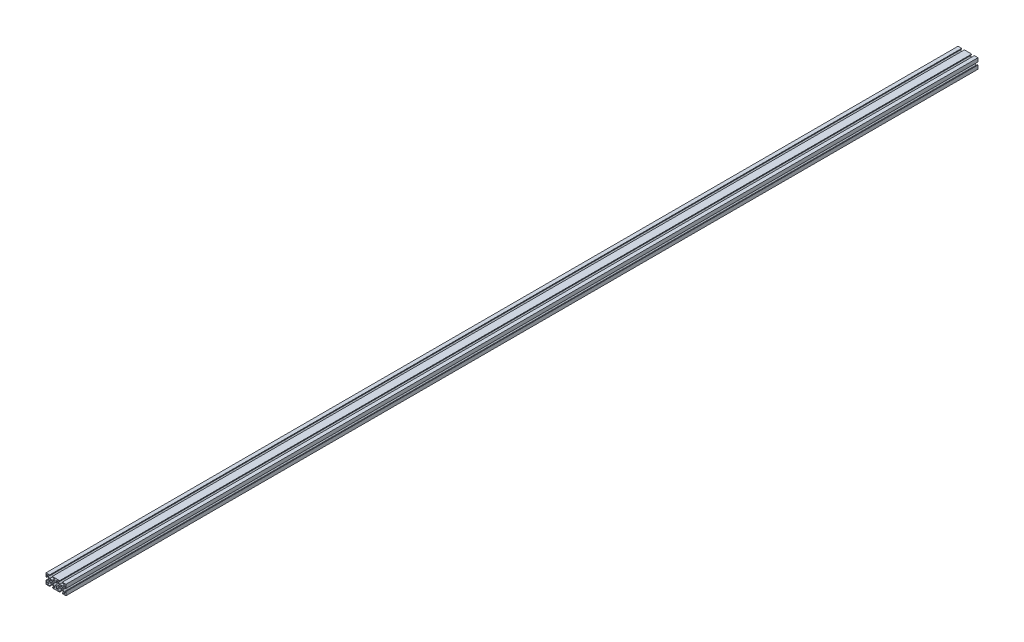
from build123d import *

# Parameters (mm, degrees)
SKETCH1_R           = 2.095
BOSS_EXTRUDE1_DEPTH = 1830
LPATTERN1_COUNT     = 2
LPATTERN1_PITCH     = 20


with BuildPart() as part:
    # Sketch1 → Boss-Extrude1 (new body)
    with BuildSketch(Plane.XY):
        Polygon((6.345, 12.594339828), (1.5, 17.439339828), (1.5, 12.63), (0, 12.63), (0, 20), (7.37, 20), (7.37, 18.5), (2.560660172, 18.5), (7.405660172, 13.655), (12.594339828, 13.655), (17.439339828, 18.5), (12.63, 18.5), (12.63, 20), (20, 20), (20, 12.63), (18.5, 12.63), (18.5, 17.439339828), (13.655, 12.594339828), (13.655, 7.405660172), (18.5, 2.560660172), (18.5, 7.37), (20, 7.37), (20, 0), (12.63, 0), (12.63, 1.5), (17.439339828, 1.5), (12.594339828, 6.345), (7.405660172, 6.345), (2.560660172, 1.5), (7.37, 1.5), (7.37, 0), (0, 0), (0, 7.37), (1.5, 7.37), (1.5, 2.560660172), (6.345, 7.405660172), align=None)
        with Locations(Location((10, 10, 0), (0, 0, 180))):
            Circle(SKETCH1_R, mode=Mode.SUBTRACT)
    boss_extrude1 = extrude(amount=BOSS_EXTRUDE1_DEPTH)

    # LPattern1: Boss-Extrude1 ×2
    with Locations(*[(i * LPATTERN1_PITCH, 0, 0) for i in range(1, LPATTERN1_COUNT)]):
        add(boss_extrude1)


solid = part.part
